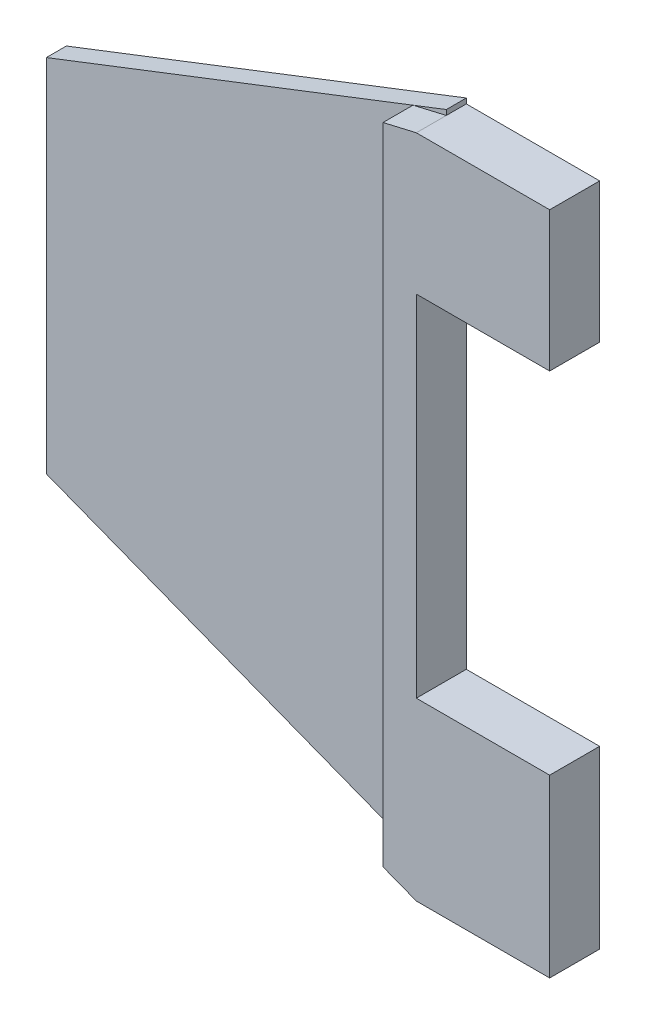
from build123d import *

# Parameters (mm, degrees)
BOSS_EXTRUDE1_DEPTH = 1.2
BOSS_EXTRUDE2_DEPTH = 3


with BuildPart() as part:
    # Sketch1 → Boss-Extrude1 (new body)
    with BuildSketch(Plane.XY):
        Polygon((0.866929529, 10.79891165), (24.866929529, 20.098165538), (24.866929529, -20.133015932), (0.866929529, -10.833762045), align=None)
    extrude(amount=BOSS_EXTRUDE1_DEPTH)

    # Sketch2 → Boss-Extrude2 (add)
    with BuildSketch(Plane(origin=(0, 0, 0), x_dir=(-1, 0, 0), z_dir=(0, 0, -1))):
        Polygon((-24.866929529, 19.789566237), (-22.866929529, 19.323227714), (-22.866929529, -19.358078108), (-24.866929529, -20.133015932), (-32.866929529, -20.133015932), (-32.866929529, -9.592041142), (-24.866929529, -9.592041142), (-24.866929529, 11.407958858), (-32.866929529, 11.407958858), (-32.866929529, 19.789566237), align=None)
    extrude(amount=-BOSS_EXTRUDE2_DEPTH)


solid = part.part
